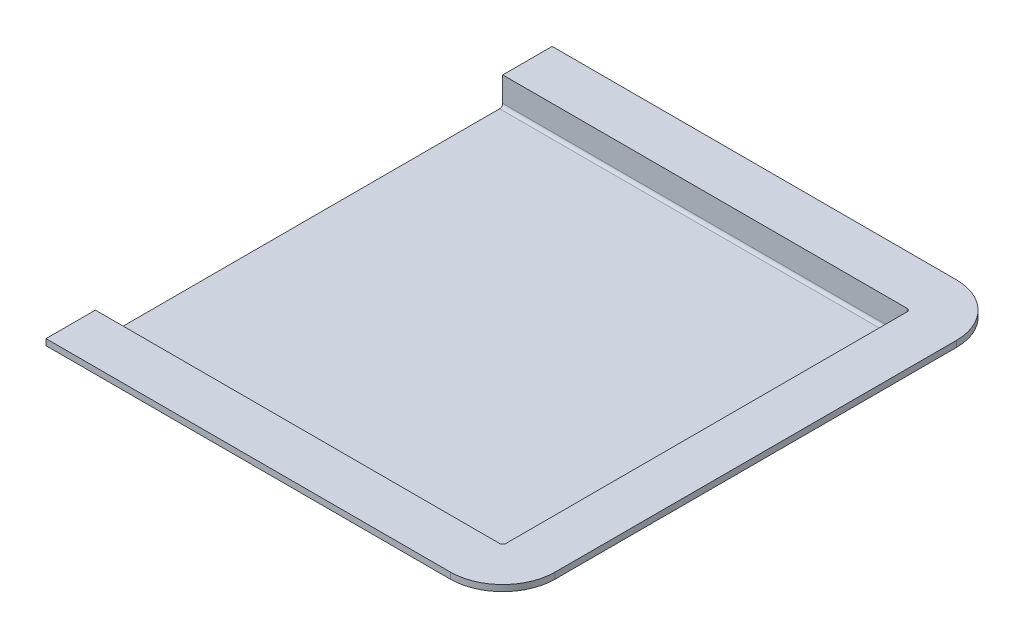
from build123d import *

# Parameters (mm, degrees)
SKETCH1_W           = 132
SKETCH1_H           = 132
BOSS_EXTRUDE1_DEPTH = 9
SHELL1_T            = 2
SKETCH2_W           = 175.70161203
SKETCH2_H           = 38.948555966
CUT_EXTRUDE1_DEPTH  = 2
FILLET1_R           = 1
FILLET2_R           = 3
BOSS_EXTRUDE2_START = -2
BOSS_EXTRUDE2_DEPTH = 2
FILLET3_R           = 3


with BuildPart() as part:
    # Sketch1 → Boss-Extrude1 (new body)
    with BuildSketch(Plane(origin=(0, 0, 0), x_dir=(1, 0, 0), z_dir=(0, 1, 0))):
        Rectangle(SKETCH1_W, SKETCH1_H)
    extrude(amount=BOSS_EXTRUDE1_DEPTH)

    # Shell1
    shell1_openings = [part.faces().sort_by_distance(p)[0] for p in [
        (0, 9, 0),
    ]]
    offset(amount=SHELL1_T, openings=shell1_openings, kind=Kind.INTERSECTION)

    # Sketch2 → Cut-Extrude1 (cut)
    with BuildSketch(Plane.ZY.offset(68)):
        Rectangle(SKETCH2_W, SKETCH2_H)
    extrude(amount=-CUT_EXTRUDE1_DEPTH, mode=Mode.SUBTRACT)

    # Fillet1
    fillet1_edges = [part.edges().sort_by_distance(p)[0] for p in [
        (0, 0, 66),
        (66, 0, 0),
        (66, 4.5, 66),
        (0, 0, -66),
        (66, 4.5, -66),
    ]]
    fillet(fillet1_edges, radius=FILLET1_R)

    # Fillet2
    fillet2_edges = [part.edges().sort_by_distance(p)[0] for p in [
        (1, -2, 68),
        (1, -2, -68),
        (68, -2, 0),
        (68, 3.5, -68),
        (68, 3.5, 68),
    ]]
    fillet(fillet2_edges, radius=FILLET2_R)

    # Sketch4 → Boss-Extrude2 (add)
    with BuildSketch(Plane(origin=(0, 9, 0), x_dir=(1, 0, 0), z_dir=(0, 1, 0)).offset(BOSS_EXTRUDE2_START)):
        with BuildLine():
            Line((-66, 82), (-66, 68))
            Line((-66, 68), (65, 68))
            ThreePointArc((65, 68), (67.121320344, 67.121320344), (68, 65))
            Line((68, 65), (68, -65))
            ThreePointArc((68, -65), (67.121320344, -67.121320344), (65, -68))
            Line((65, -68), (-66, -68))
            Line((-66, -68), (-66, -82))
            Line((-66, -82), (65, -82))
            ThreePointArc((65, -82), (77.02081528, -77.02081528), (82, -65))
            Line((82, -65), (82, 65))
            ThreePointArc((82, 65), (77.02081528, 77.02081528), (65, 82))
            Line((65, 82), (-66, 82))
        make_face()
    extrude(amount=BOSS_EXTRUDE2_DEPTH)

    # Fillet3
    fillet3_edges = [part.edges().sort_by_distance(p)[0] for p in [
        (-0.5, 7, 68),
        (67.121320344, 7, 67.121320344),
        (68, 7, 0),
        (67.121320344, 7, -67.121320344),
        (-0.5, 7, -68),
    ]]
    fillet(fillet3_edges, radius=FILLET3_R)


solid = part.part
